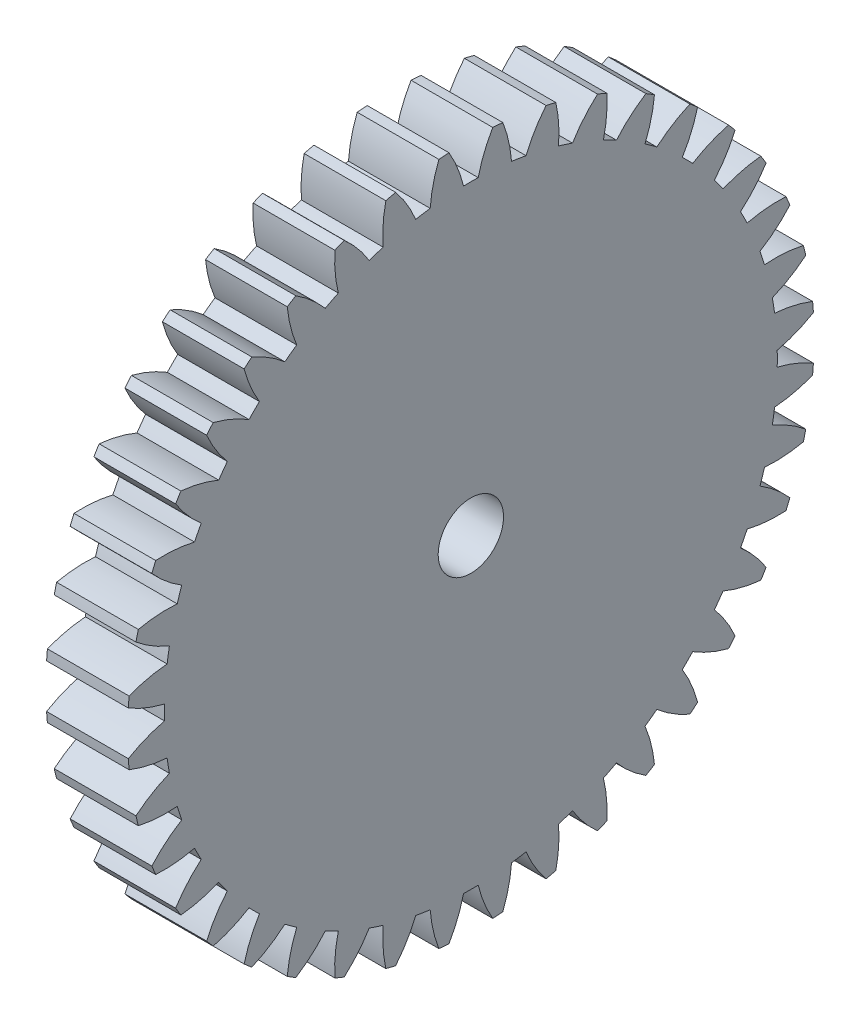
from build123d import *

# Parameters (mm, degrees)
BASPROSKE_W     = 5
BASPROSKE_H     = 21
TOOTHCUT_DEPTH  = 31.116440693
TEETHCUTS_COUNT = 40
TEETHCUTS_ANGLE = 351
BORSKE_R        = 2
BORE_DEPTH      = 50.0000508


with BuildPart() as part:
    # BasProSke → Base-Revolve (revolve)
    with BuildSketch(Plane(origin=(0, 0, 0), x_dir=(1, 0, 0), z_dir=(0, 1, 0)), mode=Mode.PRIVATE) as base_revolve_sk:
        with Locations((2.5, 10.5)):
            Rectangle(BASPROSKE_W, BASPROSKE_H)
    revolve(base_revolve_sk.sketch.rotate(Axis((-10, 0, 0), (1, 0, 0)), 180), axis=Axis((-10, 0, 0), (1, 0, 0)))

    # TooCutSke → ToothCut (cut, through all)
    with BuildSketch(Plane(origin=(0, 0, 0), x_dir=(0, 0, -1), z_dir=(1, 0, 0))):
        with BuildLine():
            ThreePointArc((0.448673268, 18.74363074), (0, 18.749), (-0.448673268, 18.74363074))
            ThreePointArc((-0.448673268, 18.74363074), (-0.816786816, 19.89705013), (-1.354745081, 20.981708961))
            ThreePointArc((-1.354745081, 20.981708961), (0, 21.0254), (1.354745081, 20.981708961))
            ThreePointArc((1.354745081, 20.981708961), (0.816786816, 19.89705013), (0.448673268, 18.74363074))
        make_face()
    toothcut = extrude(amount=TOOTHCUT_DEPTH, mode=Mode.SUBTRACT)

    # TeethCuts: ToothCut ×40 about axis
    teethcuts_axis = Axis((-10, 0, 0), (1, 0, 0))
    for i in range(1, TEETHCUTS_COUNT):
        add(toothcut.rotate(teethcuts_axis, i * TEETHCUTS_ANGLE / (TEETHCUTS_COUNT - 1)), mode=Mode.SUBTRACT)

    # BorSke → Bore (cut, symmetric)
    with BuildSketch(Plane(origin=(0, 0, 0), x_dir=(0, 0, -1), z_dir=(1, 0, 0))):
        with Locations(Location((0, 0, 0), (0, 0, 180))):
            Circle(BORSKE_R)
    extrude(amount=BORE_DEPTH, both=True, mode=Mode.SUBTRACT)


solid = part.part
